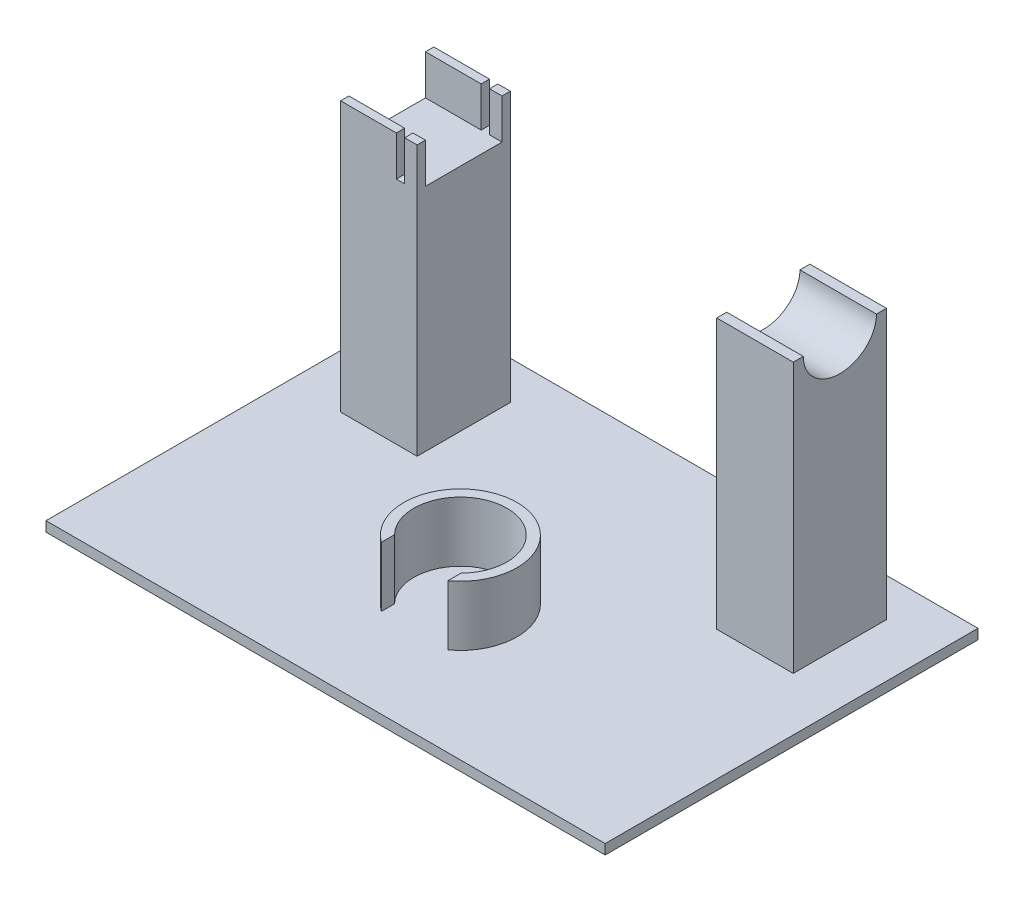
from build123d import *

# Parameters (mm, degrees)
SKETCH1_W           = 168
SKETCH1_H           = 112
BOSS_EXTRUDE1_DEPTH = 3
SKETCH2_W           = 23
SKETCH2_H           = 28
BOSS_EXTRUDE2_DEPTH = 81
SKETCH11_W          = 28
SKETCH11_H          = 23
CUT_EXTRUDE4_DEPTH  = 12
SKETCH13_W          = 2.5
SKETCH13_H          = 33.689893656
CUT_EXTRUDE5_DEPTH  = 12
SKETCH17_RX         = 11
SKETCH17_RY         = 10
CUT_EXTRUDE6_DEPTH  = 40
SKETCH18_R          = 17
BOSS_EXTRUDE3_DEPTH = 18
SKETCH19_R          = 14
CUT_EXTRUDE7_DEPTH  = 18
SKETCH20_W          = 20
SKETCH20_H          = 25.807879142
CUT_EXTRUDE8_DEPTH  = 18


with BuildPart() as part:
    # Sketch1 → Boss-Extrude1 (new body)
    with BuildSketch(Plane(origin=(0, 0, 0), x_dir=(1, 0, 0), z_dir=(0, 1, 0))):
        Rectangle(SKETCH1_W, SKETCH1_H)
    extrude(amount=BOSS_EXTRUDE1_DEPTH)

    # Sketch2 → Boss-Extrude2 (add)
    with BuildSketch(Plane(origin=(0, 3, 0), x_dir=(1, 0, 0), z_dir=(0, 1, 0))):
        with Locations((-56.5, 30.5)):
            Rectangle(SKETCH2_W, SKETCH2_H)
    boss_extrude2 = extrude(amount=BOSS_EXTRUDE2_DEPTH)

    # Mirror1: Boss-Extrude2 across plane
    add(boss_extrude2.mirror(Plane(origin=(0, 0, 0), x_dir=(0, 0, 1), z_dir=(1, 0, 0))))

    # Sketch11 → Cut-Extrude4 (cut)
    with BuildSketch(Plane(origin=(0, 84, 0), x_dir=(1, 0, 0), z_dir=(0, 1, 0))):
        with Locations((-59, 30.5)):
            Rectangle(SKETCH11_W, SKETCH11_H)
    extrude(amount=-CUT_EXTRUDE4_DEPTH, mode=Mode.SUBTRACT)

    # Sketch13 → Cut-Extrude5 (cut)
    with BuildSketch(Plane(origin=(0, 72, 0), x_dir=(1, 0, 0), z_dir=(0, 1, 0))):
        with Locations((-50, 30.5)):
            Rectangle(SKETCH13_W, SKETCH13_H)
    extrude(amount=CUT_EXTRUDE5_DEPTH, mode=Mode.SUBTRACT)

    # Sketch17 → Cut-Extrude6 (cut)
    with BuildSketch(Plane.ZY.offset(-45)):
        with Locations((-30.5, 84)):
            Ellipse(SKETCH17_RX, SKETCH17_RY)
    extrude(amount=-CUT_EXTRUDE6_DEPTH, mode=Mode.SUBTRACT)

    # Sketch18 → Boss-Extrude3 (add)
    with BuildSketch(Plane(origin=(0, 3, 0), x_dir=(1, 0, 0), z_dir=(0, 1, 0))):
        with Locations(Location((0, -15.5, 0), (0, 0, 90))):
            Circle(SKETCH18_R)
    extrude(amount=BOSS_EXTRUDE3_DEPTH)

    # Sketch19 → Cut-Extrude7 (cut)
    with BuildSketch(Plane(origin=(0, 21, 0), x_dir=(1, 0, 0), z_dir=(0, 1, 0))):
        with Locations(Location((0, -15.5, 0), (0, 0, 270))):
            Circle(SKETCH19_R)
    extrude(amount=-CUT_EXTRUDE7_DEPTH, mode=Mode.SUBTRACT)

    # Sketch20 → Cut-Extrude8 (cut)
    with BuildSketch(Plane(origin=(0, 21, 0), x_dir=(1, 0, 0), z_dir=(0, 1, 0))):
        with Locations((0, -32.5)):
            Rectangle(SKETCH20_W, SKETCH20_H)
    extrude(amount=-CUT_EXTRUDE8_DEPTH, mode=Mode.SUBTRACT)


solid = part.part
